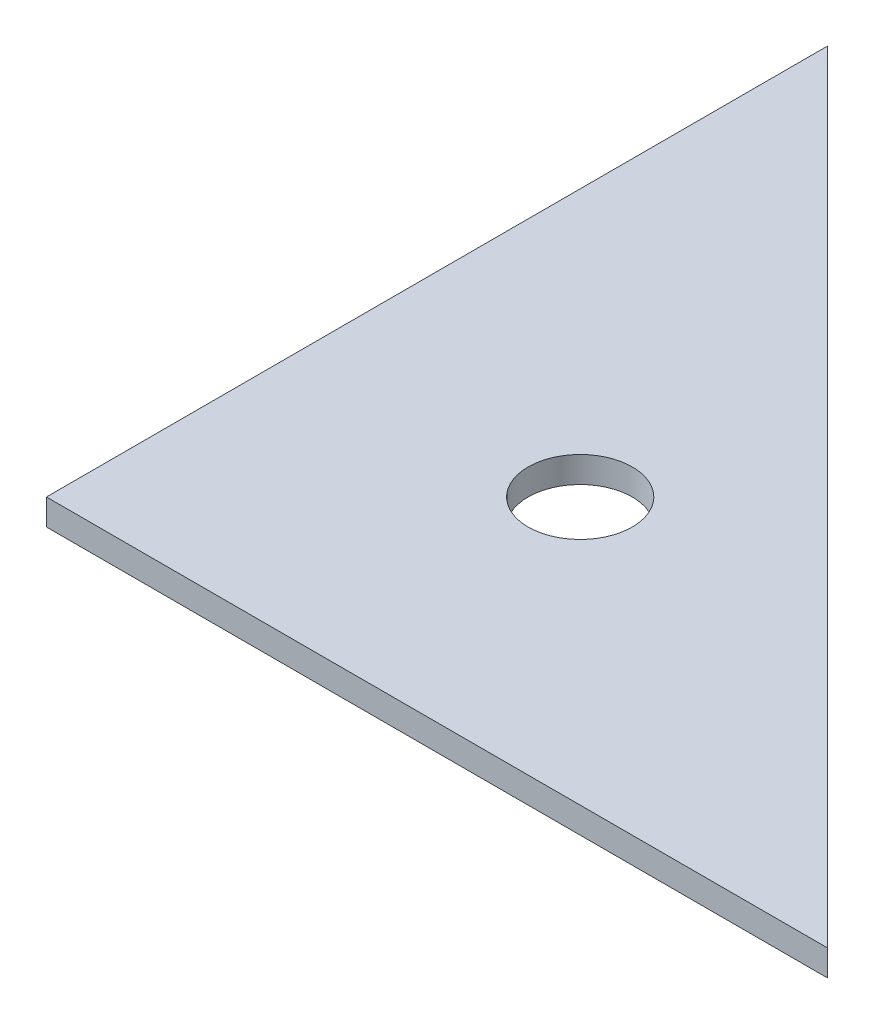
from build123d import *

# Parameters (mm, degrees)
SKETCH1_R           = 4
BOSS_EXTRUDE1_DEPTH = 2


with BuildPart() as part:
    # Sketch1 → Boss-Extrude1 (new body)
    with BuildSketch(Plane(origin=(0, 0, 0), x_dir=(1, 0, 0), z_dir=(0, 1, 0))):
        Polygon((0, 0), (60, 0), (0, 60), align=None)
        with Locations(Location((20.5, 20.5, 0), (0, 0, 270))):
            Circle(SKETCH1_R, mode=Mode.SUBTRACT)
    extrude(amount=BOSS_EXTRUDE1_DEPTH)


solid = part.part
